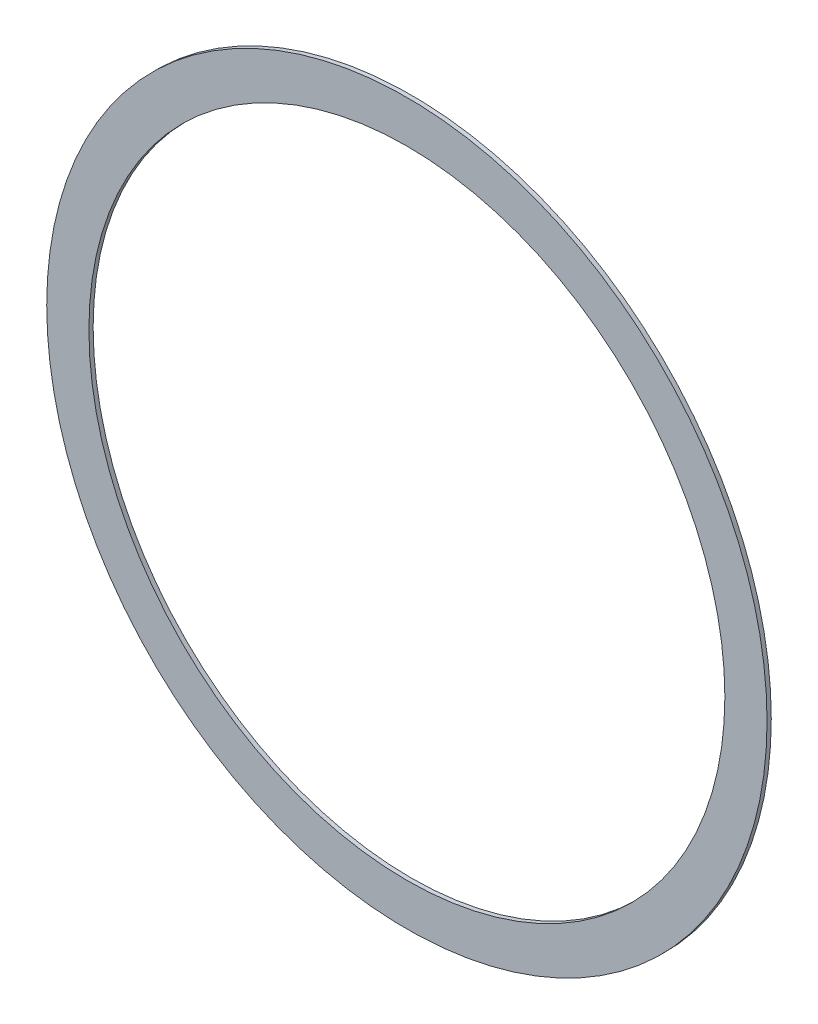
from build123d import *

# Parameters (mm, degrees)
SKETCH1_R           = 16.99
SKETCH1_R_2         = 15
BOSS_EXTRUDE1_DEPTH = 0.2
SCALE1_SCALE        = 1.9329
SCALE2_SCALE        = 1.5


with BuildPart() as part:
    # Sketch1 → Boss-Extrude1 (new body)
    with BuildSketch(Plane.XY):
        Circle(SKETCH1_R)
        Circle(SKETCH1_R_2, mode=Mode.SUBTRACT)
    extrude(amount=BOSS_EXTRUDE1_DEPTH)


with BuildPart() as part_1:
    # Scale1: scaled about (0, 0, 0.1)
    add(part.part.scale(SCALE1_SCALE).moved(Location((0, 0, -0.09329))))


with BuildPart() as part_2:
    # Scale2: scaled about (0, 0, 0.1)
    add(part_1.part.scale(SCALE2_SCALE).moved(Location((0, 0, -0.05))))


solid = part_2.part
